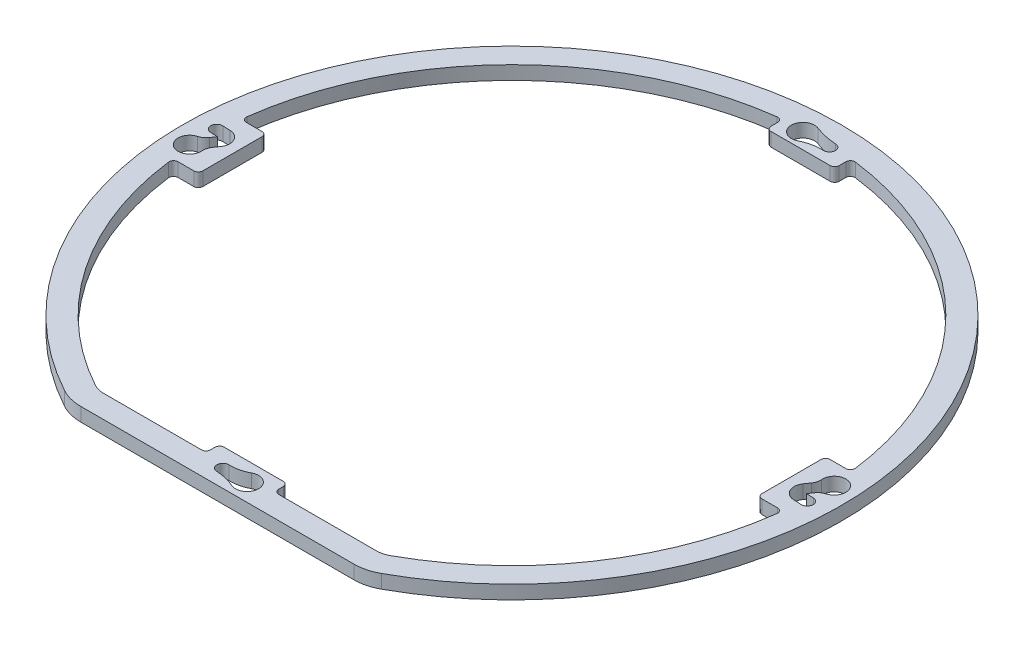
from build123d import *

# Parameters (mm, degrees)
BOSS_EXTRUDE1_DEPTH = 3
SKETCH2_W           = 15
SKETCH2_H           = 3
SKETCH2_W_2         = 6
SKETCH2_H_2         = 15
SKETCH2_H_3         = 4
BOSS_EXTRUDE2_DEPTH = 3
CUT_EXTRUDE1_DEPTH  = 103.574363269
CUT_EXTRUDE2_DEPTH  = 103.574363269
FILLET1_R           = 1


with BuildPart() as part:
    # Sketch1 → Boss-Extrude1 (new body)
    with BuildSketch(Plane(origin=(0, 0, 0), x_dir=(1, 0, 0), z_dir=(0, 1, 0))):
        with BuildLine():
            Line((-30.029977361, -64.812867647), (30.029977361, -64.812867647))
            ThreePointArc((30.029977361, -64.812867647), (32.509837414, -64.500503794), (34.834773739, -63.582926471))
            ThreePointArc((34.834773739, -63.582926471), (0, 72.5), (-34.834773739, -63.582926471))
            ThreePointArc((-34.834773739, -63.582926471), (-32.509837414, -64.500503794), (-30.029977361, -64.812867647))
        make_face()
        with BuildLine():
            Line((-30.029977361, -59.812867647), (30.029977361, -59.812867647))
            ThreePointArc((30.029977361, -59.812867647), (31.269907388, -59.656685721), (32.43237555, -59.197897059))
            ThreePointArc((32.43237555, -59.197897059), (0, 67.5), (-32.43237555, -59.197897059))
            ThreePointArc((-32.43237555, -59.197897059), (-31.269907388, -59.656685721), (-30.029977361, -59.812867647))
        make_face(mode=Mode.SUBTRACT)
    extrude(amount=BOSS_EXTRUDE1_DEPTH)

    # Sketch2 → Boss-Extrude2 (add)
    with BuildSketch(Plane(origin=(0, 3, 0), x_dir=(1, 0, 0), z_dir=(0, 1, 0))):
        with Locations((0, -58.312867647)):
            Rectangle(SKETCH2_W, SKETCH2_H)
        with Locations((-64.5, 0)):
            Rectangle(SKETCH2_W_2, SKETCH2_H_2)
        with Locations((64.5, 0)):
            Rectangle(SKETCH2_W_2, SKETCH2_H_2)
        with Locations((0, 65.5)):
            Rectangle(SKETCH2_W, SKETCH2_H_3)
    extrude(amount=-BOSS_EXTRUDE2_DEPTH)

    # Sketch3 → Cut-Extrude1 (cut, through all)
    with BuildSketch(Plane(origin=(0, 3, 0), x_dir=(1, 0, 0), z_dir=(0, 1, 0))):
        with BuildLine():
            ThreePointArc((1.616415185, -63.268268373), (5.208836136, -60.842325617), (1.43798531, -58.704249242))
            ThreePointArc((1.43798531, -58.704249242), (-0.518832115, -59.450153065), (-2.604077426, -59.643178828))
            ThreePointArc((-2.604077426, -59.643178828), (-3.959545317, -60.885236313), (-2.717487833, -62.240704205))
            ThreePointArc((-2.717487833, -62.240704205), (-0.501795592, -62.548915084), (1.616415185, -63.268268373))
        make_face()
        with BuildLine():
            ThreePointArc((2.86579375, 65.637468158), (4.221261642, 66.879525642), (2.979204157, 68.234993534))
            ThreePointArc((2.979204157, 68.234993534), (0.457508066, 68.55960428), (-1.973827963, 69.303195854))
            ThreePointArc((-1.973827963, 69.303195854), (-5.470477452, 66.834714499), (-1.788525063, 64.652242401))
            ThreePointArc((-1.788525063, 64.652242401), (0.476176032, 65.439915463), (2.86579375, 65.637468158))
        make_face()
    extrude(amount=-CUT_EXTRUDE1_DEPTH, mode=Mode.SUBTRACT)

    # Sketch4 → Cut-Extrude2 (cut, through all)
    with BuildSketch(Plane(origin=(0, 3, 0), x_dir=(1, 0, 0), z_dir=(0, 1, 0))):
        with BuildLine():
            Line((-67.991984271, 1.667355653), (-66.410615041, 1.598311581))
            Line((-66.410615041, 1.598311581), (-67.139557844, 0.548042688))
            ThreePointArc((-67.139557844, 0.548042688), (-67.790591563, -0.111174979), (-68.626151234, -0.511490946))
            ThreePointArc((-68.626151234, -0.511490946), (-69.389235809, -5.060995376), (-65.394055237, -2.75473849))
            ThreePointArc((-65.394055237, -2.75473849), (-65.311299925, -1.831936022), (-64.921452747, -0.991440921))
            Line((-64.921452747, -0.991440921), (-64.156516626, 0.110687546))
            ThreePointArc((-64.156516626, 0.110687546), (-63.962986737, 2.747929937), (-66.179059274, 4.190678619))
            Line((-66.179059274, 4.190678619), (-67.878573864, 4.264881029))
            ThreePointArc((-67.878573864, 4.264881029), (-69.234041756, 3.022823544), (-67.991984271, 1.667355653))
        make_face()
        with BuildLine():
            Line((67.991984271, -1.667355653), (66.410615041, -1.598311581))
            Line((66.410615041, -1.598311581), (67.139557844, -0.548042688))
            ThreePointArc((67.139557844, -0.548042688), (67.790591563, 0.111174979), (68.626151234, 0.511490946))
            ThreePointArc((68.626151234, 0.511490946), (69.389235809, 5.060995376), (65.394055237, 2.75473849))
            ThreePointArc((65.394055237, 2.75473849), (65.311299925, 1.831936022), (64.921452747, 0.991440921))
            Line((64.921452747, 0.991440921), (64.156516626, -0.110687546))
            ThreePointArc((64.156516626, -0.110687546), (63.962986737, -2.747929937), (66.179059274, -4.190678619))
            Line((66.179059274, -4.190678619), (67.878573864, -4.264881029))
            ThreePointArc((67.878573864, -4.264881029), (69.234041756, -3.022823544), (67.991984271, -1.667355653))
        make_face()
    extrude(amount=-CUT_EXTRUDE2_DEPTH, mode=Mode.SUBTRACT)

    # Fillet1
    fillet1_edges = [part.edges().sort_by_distance(p)[0] for p in [
        (7.5, 1.5, 56.812867647),
        (7.5, 1.5, 59.812867647),
        (-7.5, 1.5, 59.812867647),
        (-7.5, 1.5, 56.812867647),
        (-67.082039325, 1.5, -7.5),
        (-67.082039325, 1.5, 7.5),
        (-61.5, 1.5, -7.5),
        (-61.5, 1.5, 7.5),
        (67.082039325, 1.5, 7.5),
        (67.082039325, 1.5, -7.5),
        (61.5, 1.5, 7.5),
        (61.5, 1.5, -7.5),
        (7.5, 1.5, -67.082039325),
        (7.5, 1.5, -63.5),
        (-7.5, 1.5, -67.082039325),
        (-7.5, 1.5, -63.5),
    ]]
    fillet(fillet1_edges, radius=FILLET1_R)


solid = part.part
